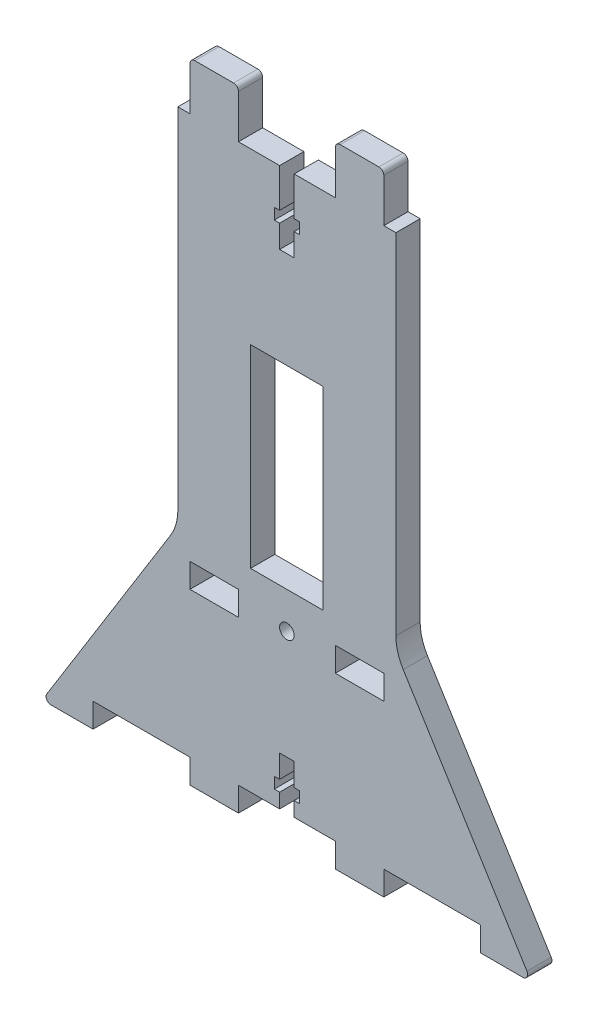
from build123d import *

# Parameters (mm, degrees)
BOSS_EXTRUDE1_DEPTH = 5
SKETCH2_R           = 1.5
SKETCH2_W           = 10
SKETCH2_H           = 5
SKETCH2_W_2         = 15
SKETCH2_H_2         = 40
CUT_EXTRUDE1_DEPTH  = 10
FILLET1_R           = 10
FILLET2_R           = 1
CONG_1_R            = 1


with BuildPart() as part:
    # Sketch1 → Boss-Extrude1 (new body)
    with BuildSketch(Plane.XY):
        Polygon((-50.018889855, -56.191512275), (-30.018889855, -56.191512275), (-30.018889855, -61.191512275), (-20.018889855, -61.191512275), (-20.018889855, -56.191512275), (-11.518889855, -56.191512275), (-11.518889855, -53.191512275), (-12.618889855, -53.191512275), (-12.618889855, -50.891512275), (-11.518889855, -50.891512275), (-11.518889855, -46.191512275), (-8.518889855, -46.191512275), (-8.518889855, -50.891512275), (-7.418889855, -50.891512275), (-7.418889855, -53.191512275), (-8.518889855, -53.191512275), (-8.518889855, -56.191512275), (-0.018889855, -56.191512275), (-0.018889855, -61.191512275), (9.981110145, -61.191512275), (9.981110145, -56.191512275), (29.981110145, -56.191512275), (29.981110145, -61.191512275), (40.481110145, -61.191512275), (12.481110145, -16.103821473), (12.481110145, 58.808487725), (9.981110145, 58.808487725), (9.981110145, 68.808487725), (-0.018889855, 68.808487725), (-0.018889855, 58.808487725), (-8.518889855, 58.808487725), (-8.518889855, 50.808487725), (-7.418889855, 50.808487725), (-7.418889855, 48.508487725), (-8.518889855, 48.508487725), (-8.518889855, 43.808487725), (-11.518889855, 43.808487725), (-11.518889855, 48.508487725), (-12.618889855, 48.508487725), (-12.618889855, 50.808487725), (-11.518889855, 50.808487725), (-11.518889855, 58.808487725), (-20.018889855, 58.808487725), (-20.018889855, 68.808487725), (-30.018889855, 68.808487725), (-30.018889855, 58.808487725), (-32.518889855, 58.808487725), (-32.518889855, -16.103821473), (-60.518889855, -61.191512275), (-50.018889855, -61.191512275), align=None)
    extrude(amount=BOSS_EXTRUDE1_DEPTH)

    # Sketch2 → Cut-Extrude1 (cut)
    with BuildSketch(Plane.XY.offset(5)):
        with Locations((-10.018889855, -23.691512275)):
            Circle(SKETCH2_R)
        with Locations((-25.018889855, -23.691512275)):
            Rectangle(SKETCH2_W, SKETCH2_H)
        with Locations((4.981110145, -23.691512275)):
            Rectangle(SKETCH2_W, SKETCH2_H)
        with Locations((-10.018889855, 3.808487725)):
            Rectangle(SKETCH2_W_2, SKETCH2_H_2)
    extrude(amount=-CUT_EXTRUDE1_DEPTH, mode=Mode.SUBTRACT)

    # Fillet1
    fillet1_edges = [part.edges().sort_by_distance(p)[0] for p in [
        (-32.518889855, -16.103821473, 2.5),
        (12.481110145, -16.103821473, 2.5),
    ]]
    fillet(fillet1_edges, radius=FILLET1_R)

    # Fillet2
    fillet2_edges = [part.edges().sort_by_distance(p)[0] for p in [
        (40.481110145, -61.191512275, 2.5),
        (-60.518889855, -61.191512275, 2.5),
    ]]
    fillet(fillet2_edges, radius=FILLET2_R)

    # Congé1
    cong_1_edges = [part.edges().sort_by_distance(p)[0] for p in [
        (-30.018889855, 68.808487725, 2.5),
        (-20.018889855, 68.808487725, 2.5),
        (-0.018889855, 68.808487725, 2.5),
        (9.981110145, 68.808487725, 2.5),
    ]]
    fillet(cong_1_edges, radius=CONG_1_R)


solid = part.part
